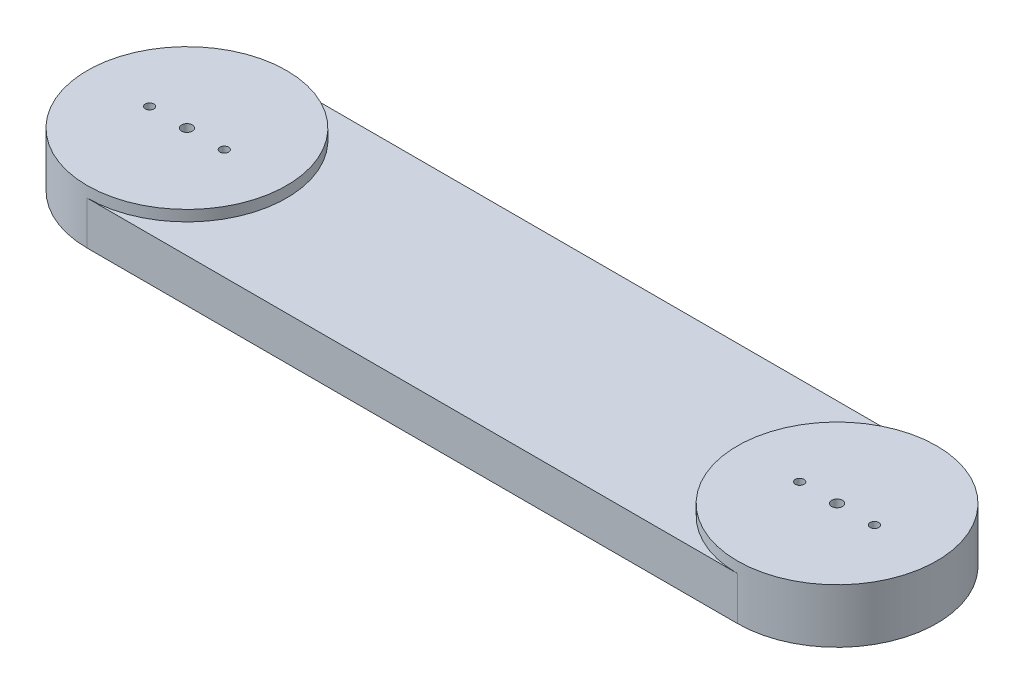
from build123d import *

# Parameters (mm, degrees)
SKETCH_1_W          = 300
SKETCH_1_H          = 92
EXTRUDE_1_DEPTH     = 20
SKETCH_2_R          = 46
EXTRUDE_2_DEPTH     = 25
SKETCH_3_R          = 2.5
SKETCH_3_R_2        = 2
CUT_EXTRUDE_1_DEPTH = 203.871880752
SKETCH_4_R          = 2.5
SKETCH_4_R_2        = 2
CUT_EXTRUDE_2_DEPTH = 203.871880752
SKETCH_5_R          = 29.5
CUT_EXTRUDE_3_DEPTH = 6.6


with BuildPart() as part:
    # 草图1 → 凸台-拉伸1 (new body)
    with BuildSketch(Plane(origin=(0, 0, 0), x_dir=(1, 0, 0), z_dir=(0, 1, 0))):
        Rectangle(SKETCH_1_W, SKETCH_1_H)
    extrude(amount=EXTRUDE_1_DEPTH)

    # 草图2 → 凸台-拉伸2 (add)
    with BuildSketch(Plane.XZ):
        with Locations(Location((-150, 0, 0), (0, 0, 270))):
            Circle(SKETCH_2_R)
        with Locations(Location((150, 0, 0), (0, 0, 270))):
            Circle(SKETCH_2_R)
    extrude(amount=-EXTRUDE_2_DEPTH)

    # 草图3 → 切除-拉伸1 (cut, through all)
    with BuildSketch(Plane(origin=(0, 25, 0), x_dir=(1, 0, 0), z_dir=(0, 1, 0))):
        with Locations(Location((150, 0, 0), (0, 0, 270))):
            Circle(SKETCH_3_R)
        with Locations(Location((167.25, 0, 0), (0, 0, 270))):
            Circle(SKETCH_3_R_2)
        with Locations(Location((132.75, 0, 0), (0, 0, 270))):
            Circle(SKETCH_3_R_2)
    extrude(amount=-CUT_EXTRUDE_1_DEPTH, mode=Mode.SUBTRACT)

    # 草图4 → 切除-拉伸2 (cut, through all)
    with BuildSketch(Plane(origin=(0, 25, 0), x_dir=(1, 0, 0), z_dir=(0, 1, 0))):
        with Locations(Location((-150, 0, 0), (0, 0, 270))):
            Circle(SKETCH_4_R)
        with Locations(Location((-132.75, 0, 0), (0, 0, 270))):
            Circle(SKETCH_4_R_2)
        with Locations(Location((-167.25, 0, 0), (0, 0, 270))):
            Circle(SKETCH_4_R_2)
    extrude(amount=-CUT_EXTRUDE_2_DEPTH, mode=Mode.SUBTRACT)

    # 草图5 → 切除-拉伸3 (cut)
    with BuildSketch(Plane.XZ):
        with Locations(Location((-150, 0, 0), (0, 0, 270))):
            Circle(SKETCH_5_R)
    extrude(amount=-CUT_EXTRUDE_3_DEPTH, mode=Mode.SUBTRACT)


solid = part.part
